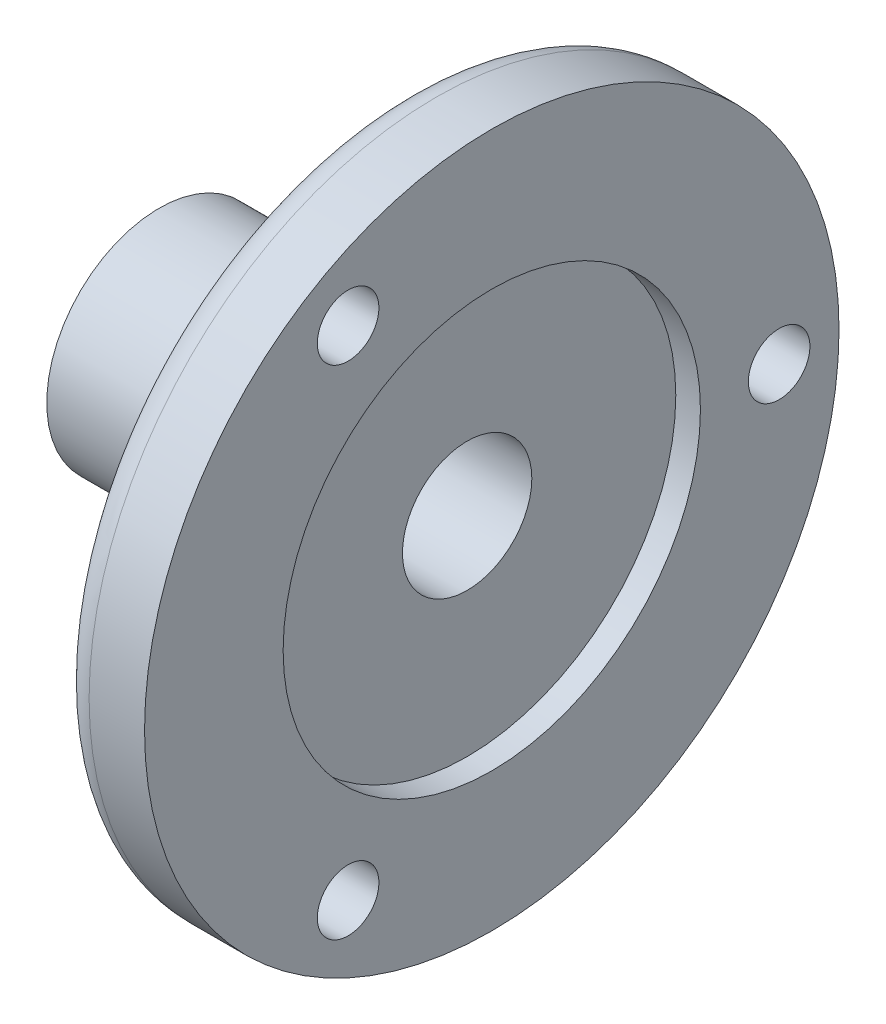
from build123d import *

# Parameters (mm, degrees)
SKETCH3_R           = 3.65
SKETCH3_R_2         = 2.1
BOSS_EXTRUDE3_DEPTH = 10
BOSS_EXTRUDE5_START = -2
SKETCH10_R          = 11.275
SKETCH10_R_2        = 2.1
BOSS_EXTRUDE5_DEPTH = 2
SKETCH11_R          = 11.275
SKETCH11_R_2        = 6.775
BOSS_EXTRUDE6_DEPTH = 0.8
SKETCH12_R          = 1
CUT_EXTRUDE2_DEPTH  = 2.75
FILLET3_R           = 1


with BuildPart() as part:
    # Sketch3 → Boss-Extrude3 (new body)
    with BuildSketch(Plane(origin=(0, 0, 0), x_dir=(0, 0, -1), z_dir=(1, 0, 0))):
        Circle(SKETCH3_R)
        Circle(SKETCH3_R_2, mode=Mode.SUBTRACT)
    extrude(amount=BOSS_EXTRUDE3_DEPTH)

    # Sketch10 → Boss-Extrude5 (add)
    with BuildSketch(Plane(origin=(10, 0, 0), x_dir=(0, 0, -1), z_dir=(1, 0, 0)).offset(BOSS_EXTRUDE5_START)):
        Circle(SKETCH10_R)
        Circle(SKETCH10_R_2, mode=Mode.SUBTRACT)
    extrude(amount=BOSS_EXTRUDE5_DEPTH)

    # Sketch11 → Boss-Extrude6 (add)
    with BuildSketch(Plane(origin=(10, 0, 0), x_dir=(0, 0, -1), z_dir=(1, 0, 0))):
        Circle(SKETCH11_R)
        Circle(SKETCH11_R_2, mode=Mode.SUBTRACT)
    extrude(amount=BOSS_EXTRUDE6_DEPTH)

    # Sketch12 → Cut-Extrude2 (cut)
    with BuildSketch(Plane(origin=(10.8, 0, 0), x_dir=(0, 0, -1), z_dir=(1, 0, 0))):
        with Locations((9.33, 0)):
            Circle(SKETCH12_R)
        with Locations((-4.665, 8.080017017)):
            Circle(SKETCH12_R)
        with Locations((-4.665, -8.080017017)):
            Circle(SKETCH12_R)
    extrude(amount=-CUT_EXTRUDE2_DEPTH, mode=Mode.SUBTRACT)

    # Fillet3
    fillet3_edges = [part.edges().sort_by_distance(p)[0] for p in [
        (8, 0, 11.275),
    ]]
    fillet(fillet3_edges, radius=FILLET3_R)


solid = part.part
